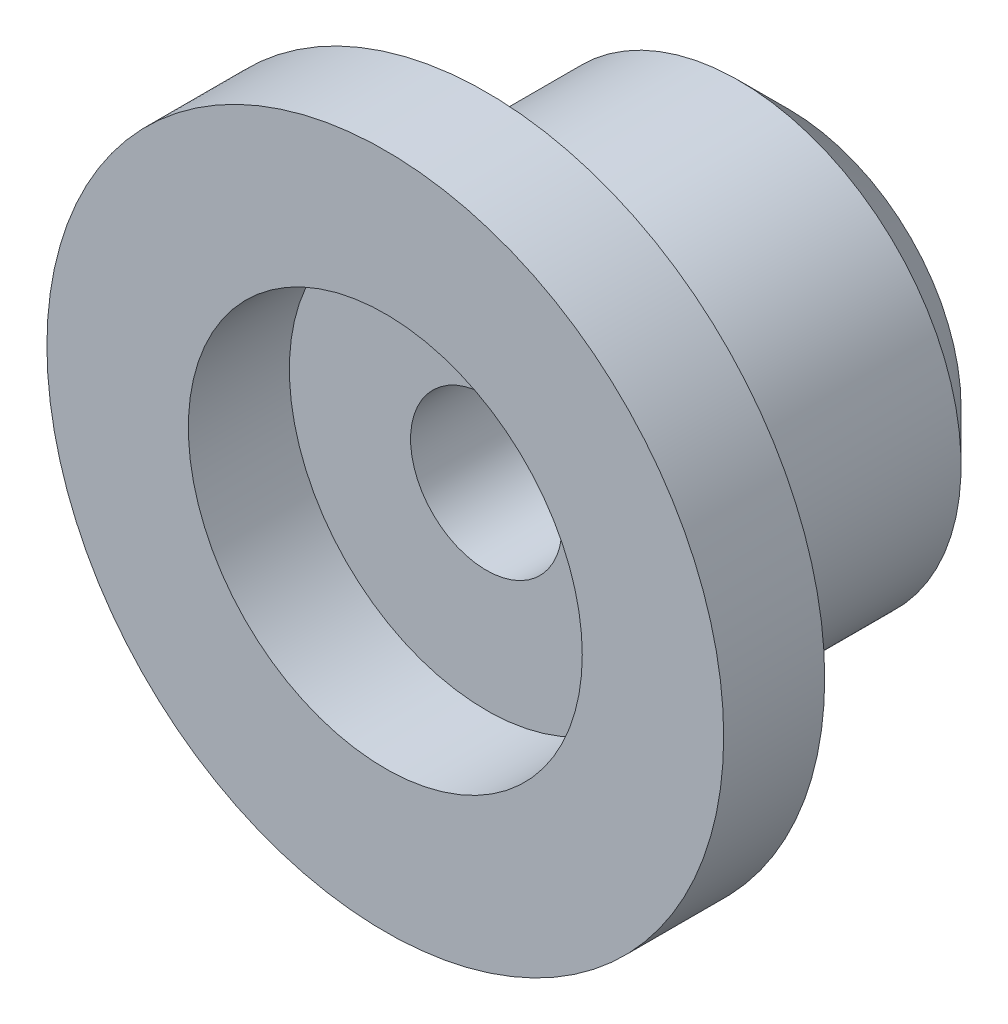
from build123d import *

# Parameters (mm, degrees)
BOSS_EXTRUDE1_DEPTH = 1
SKETCH2_R           = 2.2
BOSS_EXTRUDE2_DEPTH = 3
CHAMFER1_SIZE       = 0.5
SKETCH4_R           = 1.95
CUT_EXTRUDE1_DEPTH  = 1
SKETCH5_R           = 0.75
CUT_EXTRUDE2_DEPTH  = 2.5
SKETCH6_R           = 6.375289794
SKETCH6_R_2         = 3.35
CUT_EXTRUDE3_DEPTH  = 133.169724505


with BuildPart() as part:
    # Sketch1 → Boss-Extrude1 (new body)
    with BuildSketch(Plane.XY):
        with BuildLine():
            Line((-129.242211844, -2.033986447), (-131.980589769, -2.033986447))
            Line((-131.980589769, -2.033986447), (-131.980589769, -4.066013553))
            Line((-131.980589769, -4.066013553), (-129.242211844, -4.066013553))
            ThreePointArc((-129.242211844, -4.066013553), (-122.699999999, -3.05), (-129.242211844, -2.033986447))
        make_face()
    extrude(amount=-BOSS_EXTRUDE1_DEPTH)

    # Sketch2 → Boss-Extrude2 (add)
    with BuildSketch(Plane(origin=(0, 0, -1), x_dir=(-1, 0, 0), z_dir=(0, 0, -1))):
        with Locations((126.049999999, -3.05)):
            Circle(SKETCH2_R)
    extrude(amount=BOSS_EXTRUDE2_DEPTH)

    # Chamfer1
    chamfer1_edges = [part.edges().sort_by_distance(p)[0] for p in [
        (-123.849999999, -3.05, -4),
    ]]
    chamfer(chamfer1_edges, length=CHAMFER1_SIZE)

    # Sketch4 → Cut-Extrude1 (cut)
    with BuildSketch(Plane.XY):
        with Locations((-126.049999999, -3.05)):
            Circle(SKETCH4_R)
    extrude(amount=-CUT_EXTRUDE1_DEPTH, mode=Mode.SUBTRACT)

    # Sketch5 → Cut-Extrude2 (cut)
    with BuildSketch(Plane.XY.offset(-1)):
        with Locations((-126.049999999, -3.05)):
            Circle(SKETCH5_R)
    extrude(amount=-CUT_EXTRUDE2_DEPTH, mode=Mode.SUBTRACT)

    # Sketch6 → Cut-Extrude3 (cut, through all)
    with BuildSketch(Plane(origin=(0, 0, -1), x_dir=(-1, 0, 0), z_dir=(0, 0, -1))):
        with Locations((126.049999999, -3.05)):
            Circle(SKETCH6_R)
        with Locations(Location((126.049999999, -3.05, 0), (0, 0, 180))):
            Circle(SKETCH6_R_2, mode=Mode.SUBTRACT)
    extrude(amount=-CUT_EXTRUDE3_DEPTH, mode=Mode.SUBTRACT)


solid = part.part
